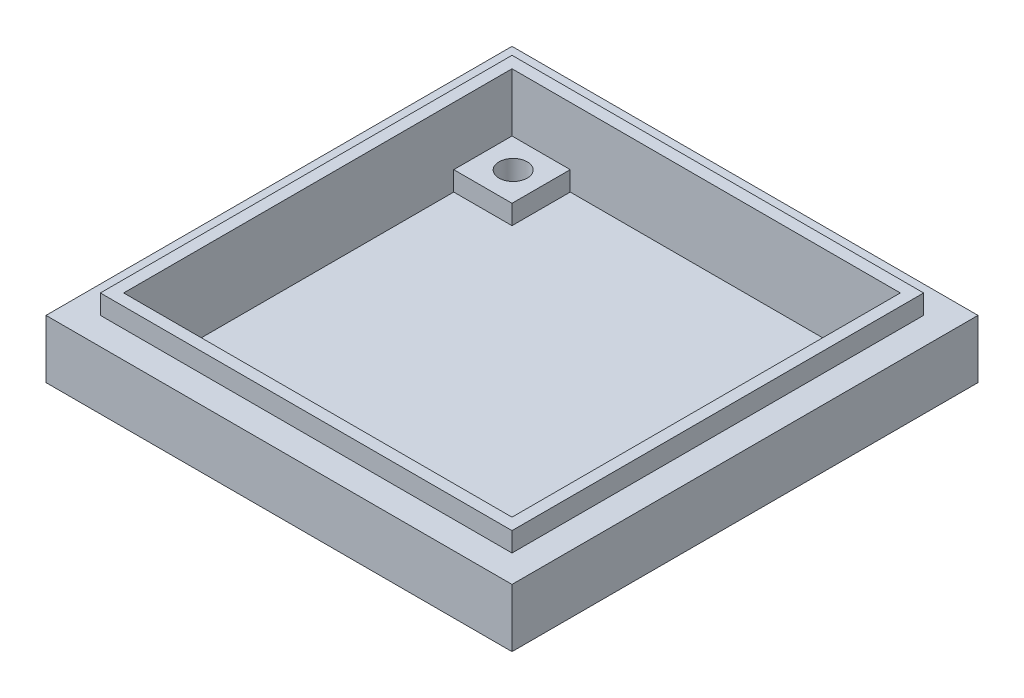
from build123d import *

# Parameters (mm, degrees)
SKETCH1_W               = 120
SKETCH1_H               = 120
SKETCH1_W_2             = 106
SKETCH1_H_2             = 106
BOSS_EXTRUDE1_DEPTH     = 20
SKETCH1_4_W             = 106
SKETCH1_4_H             = 106
SKETCH1_4_W_2           = 100
SKETCH1_4_H_2           = 100
BOSS_EXTRUDE2_DEPTH     = 25
SKETCH1_5_W             = 100
SKETCH1_5_H             = 100
BOSS_EXTRUDE3_DEPTH     = 5
SKETCH1_7_W             = 103
SKETCH1_7_H             = 103
CUT_EXTRUDE1_DEPTH      = 2
SKETCH2_W               = 15
SKETCH2_H               = 15
BOSS_EXTRUDE5_DEPTH     = 5
CUT_EXTRUDE7_DEPTH      = 112
CUT_EXTRUDE7_DEPTH_BACK = 130.755311173
SKETCH8_R               = 3.643912303
CHAMFER1_SIZE           = 5


with BuildPart() as part:
    # Sketch1 → Boss-Extrude1 (new body)
    with BuildSketch(Plane(origin=(0, 0, 0), x_dir=(1, 0, 0), z_dir=(0, 1, 0))):
        with Locations((33.717730969, -27.483870968)):
            Rectangle(SKETCH1_W, SKETCH1_H)
        with Locations((33.717730969, -27.483870968)):
            Rectangle(SKETCH1_W_2, SKETCH1_H_2, mode=Mode.SUBTRACT)
    extrude(amount=BOSS_EXTRUDE1_DEPTH)

    # Sketch1<4> → Boss-Extrude2 (add)
    with BuildSketch(Plane(origin=(0, 0, 0), x_dir=(1, 0, 0), z_dir=(0, 1, 0))):
        with Locations((33.717730969, -27.483870968)):
            Rectangle(SKETCH1_4_W, SKETCH1_4_H)
        with Locations((33.717730969, -27.483870968)):
            Rectangle(SKETCH1_4_W_2, SKETCH1_4_H_2, mode=Mode.SUBTRACT)
    extrude(amount=BOSS_EXTRUDE2_DEPTH)

    # Sketch1<5> → Boss-Extrude3 (add)
    with BuildSketch(Plane(origin=(0, 0, 0), x_dir=(1, 0, 0), z_dir=(0, 1, 0))):
        with Locations((33.717730969, -27.483870968)):
            Rectangle(SKETCH1_5_W, SKETCH1_5_H)
    extrude(amount=BOSS_EXTRUDE3_DEPTH)

    # Sketch1<7> → Cut-Extrude1 (cut)
    with BuildSketch(Plane(origin=(0, 0, 0), x_dir=(1, 0, 0), z_dir=(0, 1, 0))):
        with Locations((33.717730969, -27.483870968)):
            Rectangle(SKETCH1_7_W, SKETCH1_7_H)
    extrude(amount=CUT_EXTRUDE1_DEPTH, mode=Mode.SUBTRACT)

    # Sketch2 → Boss-Extrude5 (add)
    with BuildSketch(Plane(origin=(0, 5, 0), x_dir=(1, 0, 0), z_dir=(0, 1, 0))):
        with Locations((76.217730969, 15.016129032)):
            Rectangle(SKETCH2_W, SKETCH2_H)
        with Locations((-8.782269031, 15.016129032)):
            Rectangle(SKETCH2_W, SKETCH2_H)
        with Locations((-8.782269031, -69.983870968)):
            Rectangle(SKETCH2_W, SKETCH2_H)
        with Locations((76.217730969, -69.983870968)):
            Rectangle(SKETCH2_W, SKETCH2_H)
    extrude(amount=BOSS_EXTRUDE5_DEPTH)

    # Sketch8 → Cut-Extrude7 (cut, two sides: drawn at the far end of the back side and taken through both)
    with BuildSketch(Plane(origin=(0, 5, 0), x_dir=(1, 0, 0), z_dir=(0, 1, 0)).offset(-CUT_EXTRUDE7_DEPTH_BACK)):
        with Locations((-8.562175079, 15.090544671)):
            Circle(SKETCH8_R)
        with Locations((76.437824921, 15.090544671)):
            Circle(SKETCH8_R)
        with Locations((-8.562175079, -69.909455329)):
            Circle(SKETCH8_R)
        with Locations((76.437824921, -69.909455329)):
            Circle(SKETCH8_R)
    extrude(amount=CUT_EXTRUDE7_DEPTH + CUT_EXTRUDE7_DEPTH_BACK, mode=Mode.SUBTRACT)

    # Chamfer1
    chamfer1_edges = [part.edges().sort_by_distance(p)[0] for p in [
        (-26.282269031, 0, 27.483870968),
        (33.717730969, 0, 87.483870968),
        (93.717730969, 0, 27.483870968),
        (33.717730969, 0, -32.516129032),
    ]]
    chamfer(chamfer1_edges, length=CHAMFER1_SIZE)


solid = part.part
